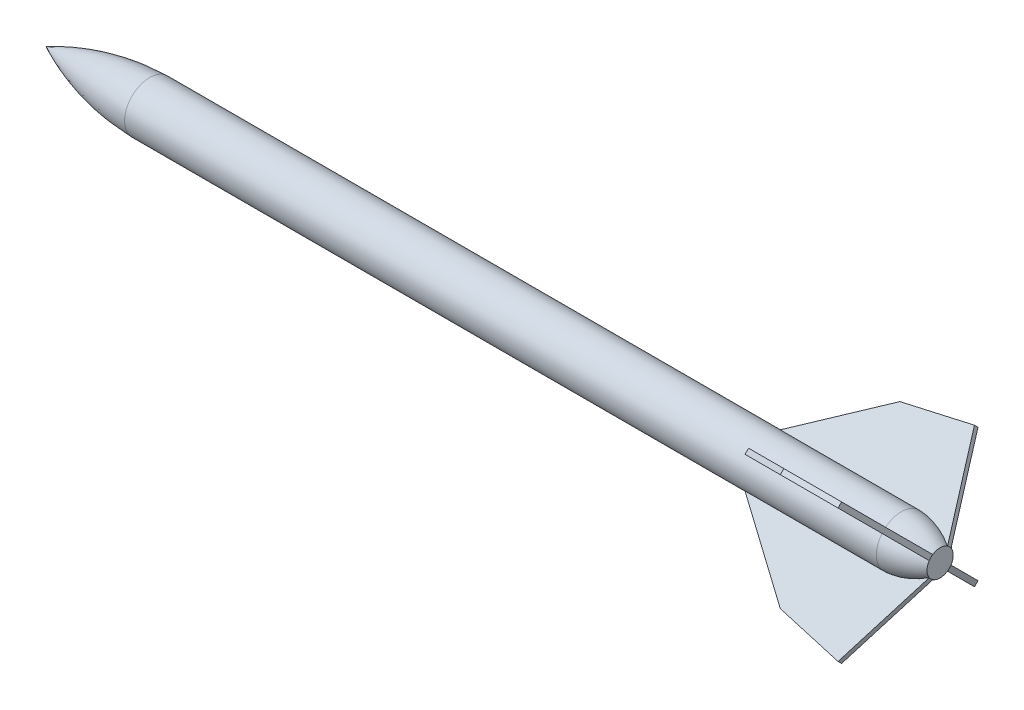
from build123d import *

# Parameters (mm, degrees)
SKETCH_1_R               = 50
SKETCH_1_R_2             = 47
EXTRUDE_1_DEPTH          = 1500
SKETCH_6_W               = 273.22987391
SKETCH_6_H               = 50
EXTRUDE_2_DEPTH          = 5
PATTERN_CIRCULAR_1_COUNT = 4
SKETCH_8_W               = 4
SKETCH_8_H               = 53
SKETCH_8_H_2             = 2
EXTRUDE_3_DEPTH          = 10
EXTRUDE_4_DEPTH          = 10


with BuildPart() as part:
    # Эскиз1 → Бобышка-Вытянуть1 (new body)
    with BuildSketch(Plane(origin=(0, 0, 0), x_dir=(0, 0, -1), z_dir=(1, 0, 0))):
        Circle(SKETCH_1_R)
        Circle(SKETCH_1_R_2, mode=Mode.SUBTRACT)
    extrude(amount=EXTRUDE_1_DEPTH)

    # Эскиз2 → Повернуть1 (revolve)
    with BuildSketch(Plane.XY, mode=Mode.PRIVATE) as revolve_1_sk:
        with BuildLine():
            Line((-206.791289072, 0), (-199.85994699, 0))
            ThreePointArc((-199.85994699, 0), (-102.380197657, 34.053574916), (0.061596531, 47.000632422))
            Line((0.061596531, 47.000632422), (0, 50))
            ThreePointArc((0, 50), (-106.115081002, 36.247115448), (-206.791289072, 0))
        make_face()
    revolve(revolve_1_sk.sketch.rotate(Axis((-1000, 0, 0), (1, 0, 0)), 270), axis=Axis((-1000, 0, 0), (1, 0, 0)))

    # Эскиз3 → Повернуть2 (revolve)
    with BuildSketch(Plane.XY, mode=Mode.PRIVATE) as revolve_2_sk:
        with BuildLine():
            ThreePointArc((1500, 47), (1538.694506081, 41.269118703), (1574.066779104, 24.568516842))
            Line((1574.066779104, 24.568516842), (1574.066779104, 28.156963524))
            ThreePointArc((1574.066779104, 28.156963524), (1538.61025126, 44.425406303), (1500, 50))
            Line((1500, 50), (1500, 47))
        make_face()
        with BuildLine():
            Line((1574.066779104, 28.156963524), (1574.066779104, 24.568516842))
            ThreePointArc((1574.066779104, 24.568516842), (1575.573800131, 23.548613165), (1577.066779104, 22.50826242))
            Line((1577.066779104, 22.50826242), (1577.066779104, 26.162351992))
            ThreePointArc((1577.066779104, 26.162351992), (1575.573359876, 27.169555583), (1574.066779104, 28.156963524))
        make_face()
        with BuildLine():
            Line((1574.066779104, 24.568516842), (1574.066779104, 0))
            Line((1574.066779104, 0), (1577.066779104, 0))
            Line((1577.066779104, 0), (1577.066779104, 22.50826242))
            ThreePointArc((1577.066779104, 22.50826242), (1575.573800131, 23.548613165), (1574.066779104, 24.568516842))
        make_face()
    revolve(revolve_2_sk.sketch.rotate(Axis((-1000, 0, 0), (1, 0, 0)), 90), axis=Axis((-1000, 0, 0), (1, 0, 0)))

    # Эскиз6 → Бобышка-Вытянуть2 (add, symmetric)
    with BuildSketch(Plane(origin=(0, 0, 0), x_dir=(-1, 0, 0), z_dir=(0, -0.7071067811865487, -0.7071067811865464))):
        with Locations((-1363.385063045, 25)):
            Rectangle(SKETCH_6_W, SKETCH_6_H)
        Polygon((-1577.066779104, 0), (-1577.066779104, 26.162351992), (-1513.072111423, 192.496021277), (-1381.053775836, 168.659377351), (-1226.77012609, 50), (-1500, 50), (-1500, 0), align=None)
    extrude_2 = extrude(amount=EXTRUDE_2_DEPTH, both=True)

    # Круговой массив1: Бобышка-Вытянуть2 ×4 about axis
    pattern_circular_1_axis = Axis((0, 0.013691373, -0.013691373), (1, 0, 0))
    for i in range(1, PATTERN_CIRCULAR_1_COUNT):
        add(extrude_2.rotate(pattern_circular_1_axis, i * 360 / PATTERN_CIRCULAR_1_COUNT))

    # Эскиз8 → Бобышка-Вытянуть3 (add, symmetric)
    with BuildSketch(Plane(origin=(300, 0, 0), x_dir=(0, 0, -1), z_dir=(1, 0, 0))):
        with Locations((0, -26.5)):
            Rectangle(SKETCH_8_W, SKETCH_8_H)
        with Locations((0, -54)):
            Rectangle(SKETCH_8_W, SKETCH_8_H_2)
        Polygon((6.171941556, -53), (2, -53), (2, -55), (-2, -55), (-2, -53), (-6.171941556, -53), (-7.5, -54.328058444), (-7.5, -57), (7.5, -57), (7.5, -54.328058444), align=None)
    extrude(amount=EXTRUDE_3_DEPTH, both=True)

    # Эскиз9 → Бобышка-Вытянуть4 (add, symmetric)
    with BuildSketch(Plane(origin=(1000, 0, 0), x_dir=(0, 0, -1), z_dir=(1, 0, 0))):
        with BuildLine():
            Line((-2, -49.959983987), (-2, -53))
            Line((-2, -53), (-6.171941556, -53))
            Line((-6.171941556, -53), (-7.5, -54.328058444))
            Line((-7.5, -54.328058444), (-7.5, -57))
            Line((-7.5, -57), (7.5, -57))
            Line((7.5, -57), (7.5, -54.328058444))
            Line((7.5, -54.328058444), (6.171941556, -53))
            Line((6.171941556, -53), (2, -53))
            Line((2, -53), (2, -49.959983987))
            ThreePointArc((2, -49.959983987), (0, -50), (-2, -49.959983987))
        make_face()
    extrude(amount=EXTRUDE_4_DEPTH, both=True)


solid = part.part
